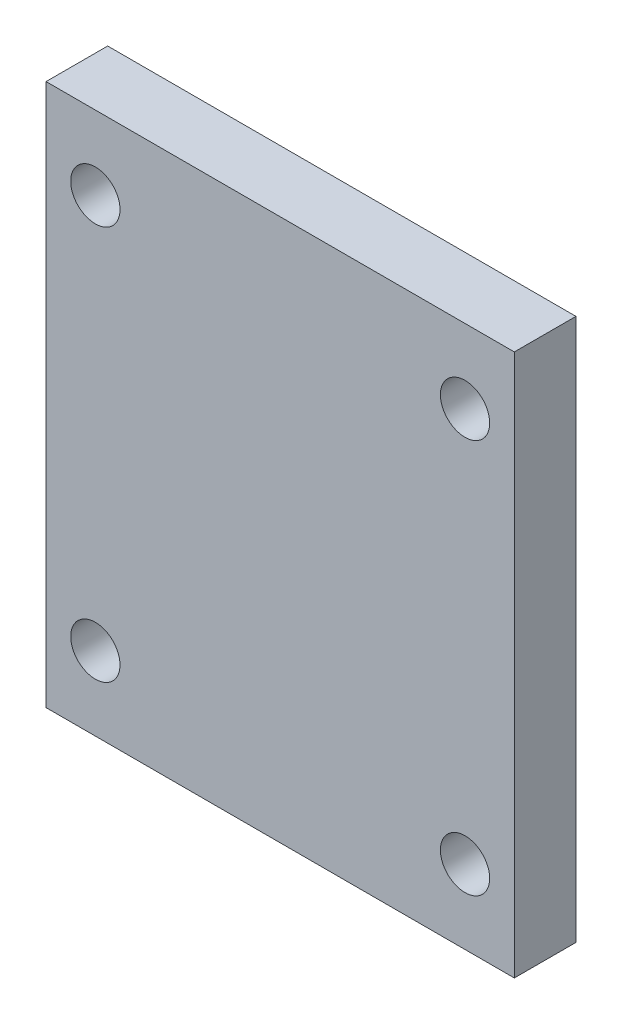
from build123d import *

# Parameters (mm, degrees)
SKETCH1_W           = 38
SKETCH1_H           = 44
SKETCH1_R           = 2
BOSS_EXTRUDE1_DEPTH = 5


with BuildPart() as part:
    # Sketch1 → Boss-Extrude1 (new body)
    with BuildSketch(Plane.XY):
        with Locations((19, 22)):
            Rectangle(SKETCH1_W, SKETCH1_H)
        with Locations((4, 38)):
            Circle(SKETCH1_R, mode=Mode.SUBTRACT)
        with Locations((34, 38)):
            Circle(SKETCH1_R, mode=Mode.SUBTRACT)
        with Locations((34, 6)):
            Circle(SKETCH1_R, mode=Mode.SUBTRACT)
        with Locations((4, 6)):
            Circle(SKETCH1_R, mode=Mode.SUBTRACT)
    extrude(amount=BOSS_EXTRUDE1_DEPTH)


solid = part.part
